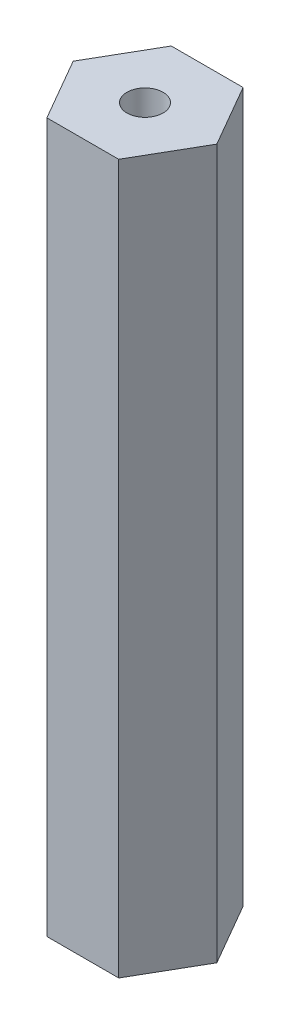
from build123d import *

# Parameters (mm, degrees)
SKETCH_1_R      = 1.45
EXTRUDE_1_DEPTH = 57


with BuildPart() as part:
    # 草图1 → 凸台-拉伸1 (new body)
    with BuildSketch(Plane(origin=(0, 0, 0), x_dir=(1, 0, 0), z_dir=(0, 1, 0))):
        Polygon((5.773502692, 0), (2.886751346, 5), (-2.886751346, 5), (-5.773502692, 0), (-2.886751346, -5), (2.886751346, -5), align=None)
        with Locations(Location((0, 0, 0), (0, 0, 90))):
            Circle(SKETCH_1_R, mode=Mode.SUBTRACT)
    extrude(amount=EXTRUDE_1_DEPTH)


solid = part.part
